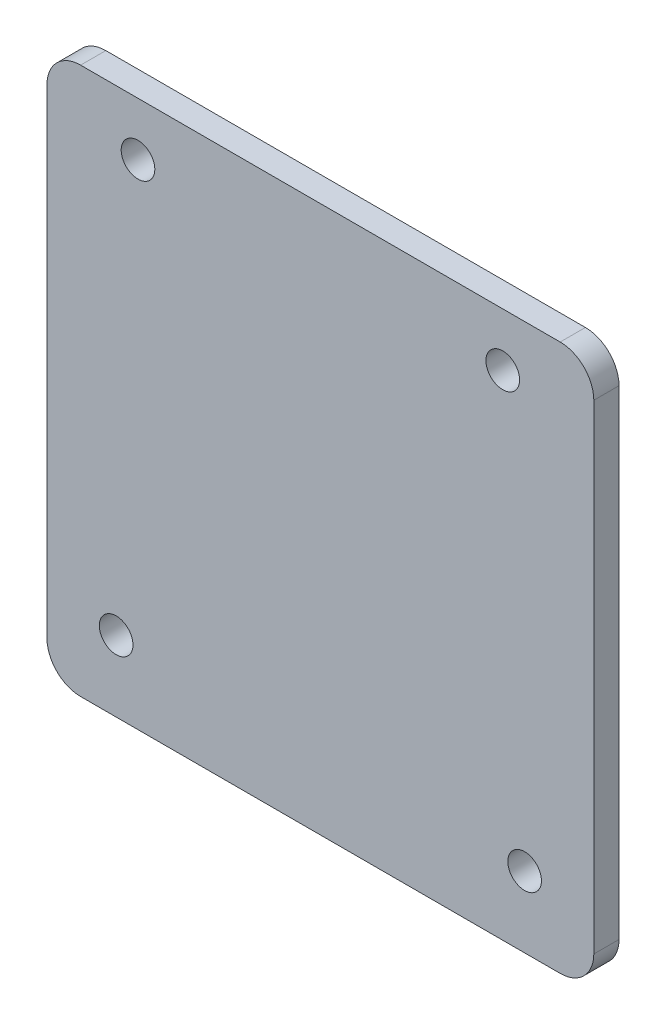
from build123d import *

# Parameters (mm, degrees)
SKETCH1_R           = 2
BOSS_EXTRUDE1_DEPTH = 3


with BuildPart() as part:
    # Sketch1 → Boss-Extrude1 (new body)
    with BuildSketch(Plane.XY):
        with BuildLine():
            Line((15.200173579, 95.290450243), (72.259569486, 95.290450243))
            ThreePointArc((72.259569486, 95.290450243), (75.08799661, 94.118877368), (76.259569486, 91.290450243))
            Line((76.259569486, 91.290450243), (76.259569486, 34.231054337))
            ThreePointArc((76.259569486, 34.231054337), (75.08799661, 31.402627212), (72.259569486, 30.231054337))
            Line((72.259569486, 30.231054337), (15.200173579, 30.231054337))
            ThreePointArc((15.200173579, 30.231054337), (12.371746455, 31.402627212), (11.200173579, 34.231054337))
            Line((11.200173579, 34.231054337), (11.200173579, 91.290450243))
            ThreePointArc((11.200173579, 91.290450243), (12.371746455, 94.118877368), (15.200173579, 95.290450243))
        make_face()
        with Locations((19.429871532, 38.66075229)):
            Circle(SKETCH1_R, mode=Mode.SUBTRACT)
        with Locations((68.029871532, 38.66075229)):
            Circle(SKETCH1_R, mode=Mode.SUBTRACT)
        with Locations((65.429871532, 88.96075229)):
            Circle(SKETCH1_R, mode=Mode.SUBTRACT)
        with Locations((22.029871532, 88.96075229)):
            Circle(SKETCH1_R, mode=Mode.SUBTRACT)
    extrude(amount=BOSS_EXTRUDE1_DEPTH)


solid = part.part
